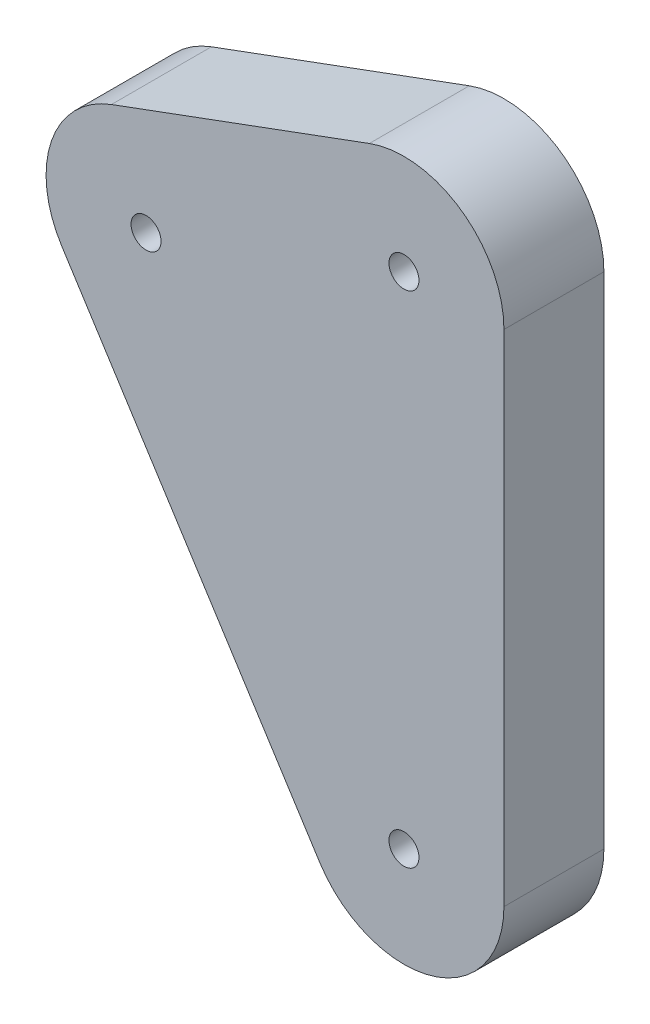
from build123d import *

# Parameters (mm, degrees)
SKETCH1_R           = 1.5
BOSS_EXTRUDE1_DEPTH = 10


with BuildPart() as part:
    # Sketch1 → Boss-Extrude1 (new body)
    with BuildSketch(Plane.XY):
        with BuildLine():
            Line((-29.261409288, 49.858838915), (-3.462727273, 59.381338915))
            ThreePointArc((-3.462727273, 59.381338915), (5.717198933, 58.204488794), (10, 50))
            Line((10, 50), (10, 0))
            ThreePointArc((10, 0), (2.79927446, -9.600211586), (-8.4328125, -5.37472542))
            Line((-8.4328125, -5.37472542), (-34.231494516, 35.10277458))
            ThreePointArc((-34.231494516, 35.10277458), (-35.275565749, 43.66947035), (-29.261409288, 49.858838915))
        make_face()
        with Locations((-25.798682016, 40.4775)):
            Circle(SKETCH1_R, mode=Mode.SUBTRACT)
        with Locations((0, 50)):
            Circle(SKETCH1_R, mode=Mode.SUBTRACT)
        Circle(SKETCH1_R, mode=Mode.SUBTRACT)
    extrude(amount=BOSS_EXTRUDE1_DEPTH)


solid = part.part
